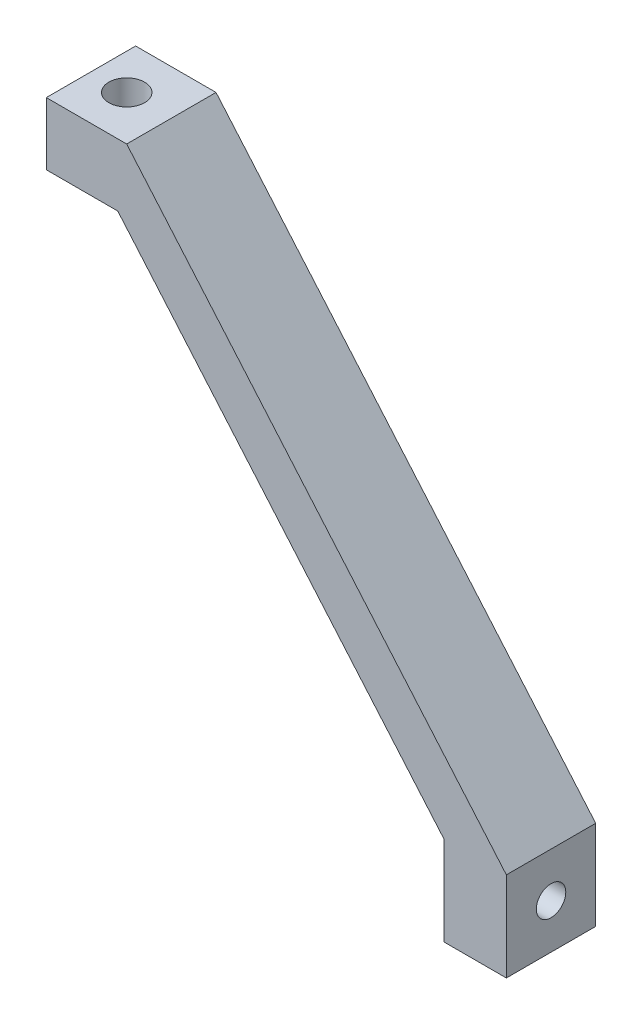
from build123d import *

# Parameters (mm, degrees)
SALIENTE_EXTRUIR1_DEPTH = 10
CROQUIS3_R              = 2
CORTAR_EXTRUIR2_DEPTH   = 10
CROQUIS4_R              = 1.65
CORTAR_EXTRUIR3_DEPTH   = 10


with BuildPart() as part:
    # Croquis1 → Saliente-Extruir1 (new body)
    with BuildSketch(Plane.XY):
        Polygon((-36.499720763, 42.6), (0, 0), (0, -10), (7, -10), (7, 0), (-35.5, 49.6), (-44.5, 49.6), (-44.5, 42.6), align=None)
    extrude(amount=SALIENTE_EXTRUIR1_DEPTH)

    # Croquis3 → Cortar-Extruir2 (cut)
    with BuildSketch(Plane(origin=(0, 49.6, 0), x_dir=(1, 0, 0), z_dir=(0, 1, 0))):
        with Locations(Location((-40.5, -5, 0), (0, 0, 270))):
            Circle(CROQUIS3_R)
    extrude(amount=-CORTAR_EXTRUIR2_DEPTH, mode=Mode.SUBTRACT)

    # Croquis4 → Cortar-Extruir3 (cut)
    with BuildSketch(Plane(origin=(7, 0, 0), x_dir=(0, 0, -1), z_dir=(1, 0, 0))):
        with Locations((-5, -5)):
            Circle(CROQUIS4_R)
    extrude(amount=-CORTAR_EXTRUIR3_DEPTH, mode=Mode.SUBTRACT)


solid = part.part
